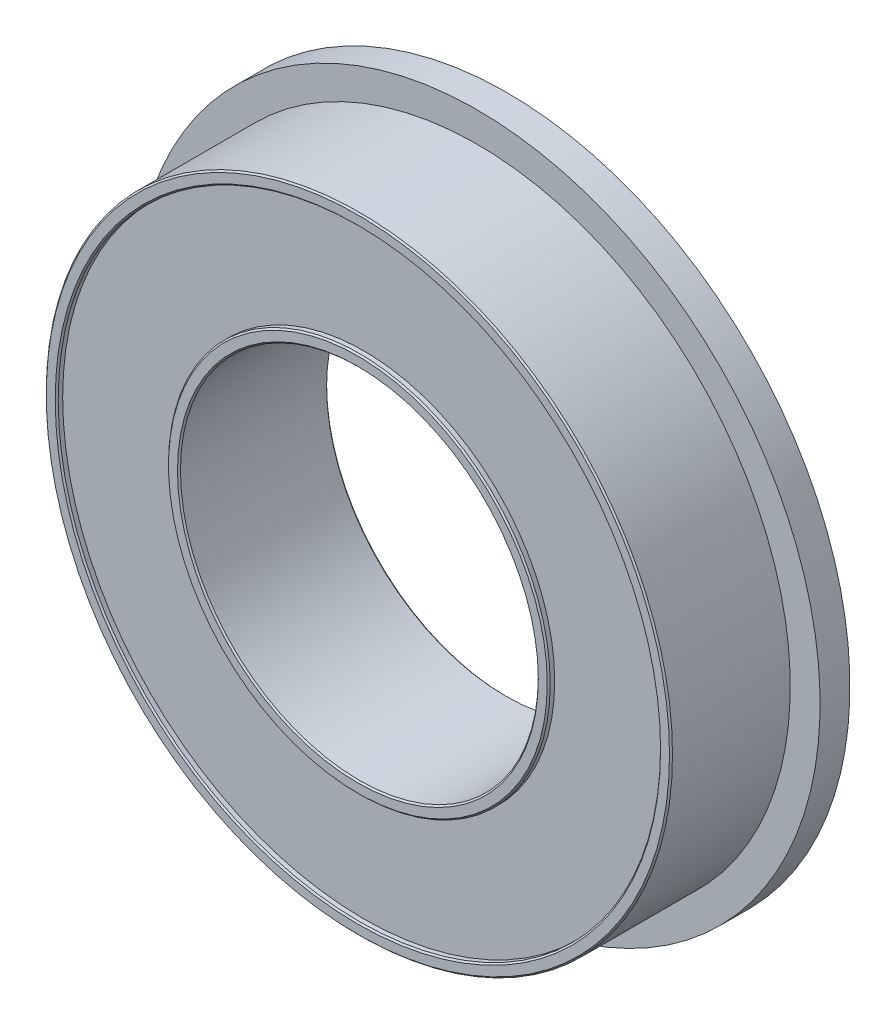
from build123d import *

# Parameters (mm, degrees)
SKETCH_1_R          = 10.5
SKETCH_1_R_2        = 6
EXTRUDE_1_DEPTH     = 2.5
SKETCH_3_R          = 11.5
SKETCH_3_R_2        = 6
EXTRUDE_2_DEPTH     = 1
SKETCH_4_R          = 10.1
SKETCH_4_R_2        = 6.4
CUT_EXTRUDE_1_DEPTH = 0.2
CHAMFER_1_SIZE      = 0.05


with BuildPart() as part:
    # 草图1 → 凸台-拉伸1 (new, symmetric)
    with BuildSketch(Plane.XY):
        Circle(SKETCH_1_R)
        Circle(SKETCH_1_R_2, mode=Mode.SUBTRACT)
    extrude(amount=EXTRUDE_1_DEPTH, both=True)

    # 草图3 → 凸台-拉伸2 (add)
    with BuildSketch(Plane(origin=(0, 0, -2.5), x_dir=(-1, 0, 0), z_dir=(0, 0, -1))):
        Circle(SKETCH_3_R)
        with Locations(Location((0, 0, 0), (0, 0, 180))):
            Circle(SKETCH_3_R_2, mode=Mode.SUBTRACT)
    extrude(amount=-EXTRUDE_2_DEPTH)

    # 草图4 → 切除-拉伸1 (cut)
    with BuildSketch(Plane.XY.offset(2.5)):
        Circle(SKETCH_4_R)
        Circle(SKETCH_4_R_2, mode=Mode.SUBTRACT)
    cut_extrude_1 = extrude(amount=-CUT_EXTRUDE_1_DEPTH, mode=Mode.SUBTRACT)

    # 镜向1: 切除-拉伸1 across plane
    add(cut_extrude_1.mirror(Plane.XY), mode=Mode.SUBTRACT)

    # 倒角1
    chamfer_1_edges = [part.edges().sort_by_distance(p)[0] for p in [
        (-10.1, 0, 2.5),
        (-6.4, 0, 2.5),
        (-6.4, 0, -2.5),
        (-10.1, 0, -2.5),
        (-10.5, 0, 2.5),
        (-6, 0, -2.5),
        (-6, 0, 2.5),
    ]]
    chamfer(chamfer_1_edges, length=CHAMFER_1_SIZE)


solid = part.part
